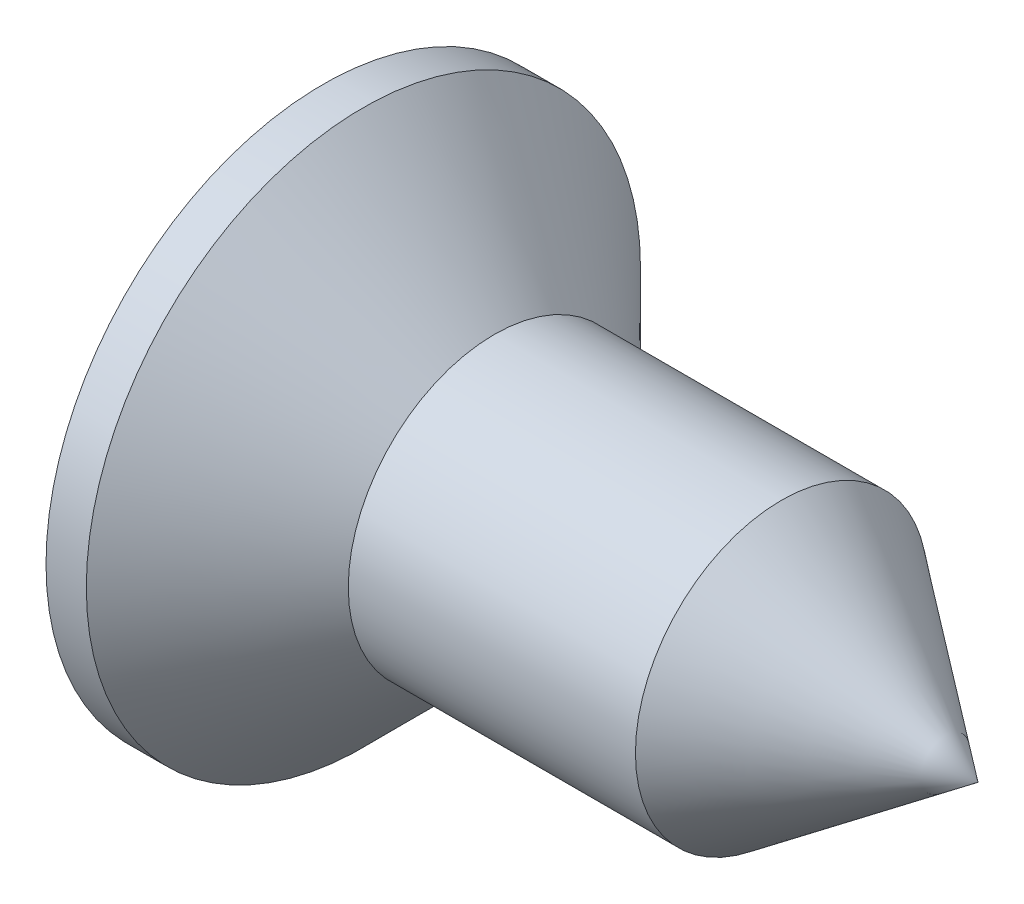
from build123d import *

# Parameters (mm, degrees)
CHAMFER1_SIZE      = 0.29
CHAMFER1_SIZE2     = 0.502294734
CUT_EXTRUDE1_DEPTH = 1.5
DRAFT1_ANGLE       = 35
DRAFT2_ANGLE       = 8


with BuildPart() as part:
    # Sketch1 → Revolve1 (revolve)
    with BuildSketch(Plane.XY, mode=Mode.PRIVATE) as revolve1_sk:
        Polygon((0, 2.75), (0.4, 2.75), (1.7, 1.45), (6.5, 1.45), (6.5, 0), (0, 0), align=None)
    revolve(revolve1_sk.sketch.rotate(Axis((6.620684694, 0, 0), (-1, 0, 0)), 90), axis=Axis((6.620684694, 0, 0), (-1, 0, 0)))

    # Chamfer1
    chamfer1_edges = [part.edges().sort_by_distance(p)[0] for p in [
        (6.5, 0, 1.45),
    ]]
    chamfer1_side = [part.faces().sort_by_distance(p)[0] for p in [
        (6.5, 0, 0),
    ]]
    chamfer(chamfer1_edges, length=CHAMFER1_SIZE, length2=CHAMFER1_SIZE2, reference=chamfer1_side[0])

    # Sketch3 → EndCone (revolve, cut)
    with BuildSketch(Plane.XY, mode=Mode.PRIVATE) as endcone_sk:
        Polygon((4.55, 1.45), (6.5, 1.45), (6.7, 1.45), (6.7, 0), (6.5, 0), align=None)
    revolve(endcone_sk.sketch.rotate(Axis((2.9, 0, 0), (1, 0, 0)), 270), axis=Axis((2.9, 0, 0), (1, 0, 0)), mode=Mode.SUBTRACT)

    # Sketch4 → Cut-Extrude1 (cut)
    with BuildSketch(Plane.ZY):
        Polygon((-0.4, 1.6), (-0.4, 0.4), (-1.6, 0.4), (-1.6, -0.4), (-0.4, -0.4), (-0.4, -1.6), (0.4, -1.6), (0.4, -0.4), (1.6, -0.4), (1.6, 0.4), (0.4, 0.4), (0.4, 1.6), align=None)
    extrude(amount=-CUT_EXTRUDE1_DEPTH, mode=Mode.SUBTRACT)

    # Draft1
    draft1_faces = [part.faces().sort_by_distance(p)[0] for p in [
        (0.75, 0, 1.6),
        (0.75, 1.6, 0),
        (0.75, 0, -1.6),
        (0.75, -1.6, 0),
    ]]
    draft(draft1_faces, Plane(origin=(0, 0, 0), x_dir=(0, 0, -1), z_dir=(-1, 0, 0)), DRAFT1_ANGLE)

    # Draft2
    draft2_faces = [part.faces().sort_by_distance(p)[0] for p in [
        (0.555453044, -0.805533796, -0.4),
        (0.555453044, -0.4, -0.805533796),
        (0.555453044, -0.4, 0.805533796),
        (0.555453044, -0.805533796, 0.4),
        (0.555453044, 0.805533796, 0.4),
        (0.555453044, 0.4, 0.805533796),
        (0.555453044, 0.4, -0.805533796),
        (0.555453044, 0.805533796, -0.4),
    ]]
    draft(draft2_faces, Plane(origin=(0, 0, 0), x_dir=(0, 0, -1), z_dir=(-1, 0, 0)), DRAFT2_ANGLE)

    # Sketch6 for Cut-Loft1 → Cut-Loft1 section 0
    with BuildSketch(Plane.ZY.offset(-1.5)):
        with BuildLine():
            Line((-0.36943872, 0.189188748), (-0.36943872, -0.189188748))
            # circular arc as an exact rational Bezier (weights 1, cos(half-angle), 1)
            Bezier((-0.36943872, -0.189188748), (-0.189188748, -0.189188748), (-0.189188748, -0.36943872), weights=[1, 0.707106781, 1])
            Line((-0.189188748, -0.36943872), (0.189188748, -0.36943872))
            Bezier((0.189188748, -0.36943872), (0.189188748, -0.189188748), (0.36943872, -0.189188748), weights=[1, 0.707106781, 1])
            Line((0.36943872, -0.189188748), (0.36943872, 0.189188748))
            Bezier((0.36943872, 0.189188748), (0.189188748, 0.189188748), (0.189188748, 0.36943872), weights=[1, 0.707106781, 1])
            Line((0.189188748, 0.36943872), (-0.189188748, 0.36943872))
            Bezier((-0.189188748, 0.36943872), (-0.189188748, 0.189188748), (-0.36943872, 0.189188748), weights=[1, 0.707106781, 1])
        make_face()
    # Sketch7 for Cut-Loft1 → Cut-Loft1 section 1
    with BuildSketch(Plane.ZY):
        with BuildLine():
            Line((0.580249972, 0.4), (0.580249972, -0.4))
            Bezier((0.580249972, -0.4), (0.4, -0.4), (0.4, -0.580249972), weights=[1, 0.707106781, 1])
            Line((0.4, -0.580249972), (-0.4, -0.580249972))
            Bezier((-0.4, -0.580249972), (-0.4, -0.4), (-0.580249972, -0.4), weights=[1, 0.707106781, 1])
            Line((-0.580249972, -0.4), (-0.580249972, 0.4))
            Bezier((-0.580249972, 0.4), (-0.4, 0.4), (-0.4, 0.580249972), weights=[1, 0.707106781, 1])
            Line((-0.4, 0.580249972), (0.4, 0.580249972))
            Bezier((0.4, 0.580249972), (0.4, 0.4), (0.580249972, 0.4), weights=[1, 0.707106781, 1])
        make_face()
    loft(mode=Mode.SUBTRACT)


solid = part.part
